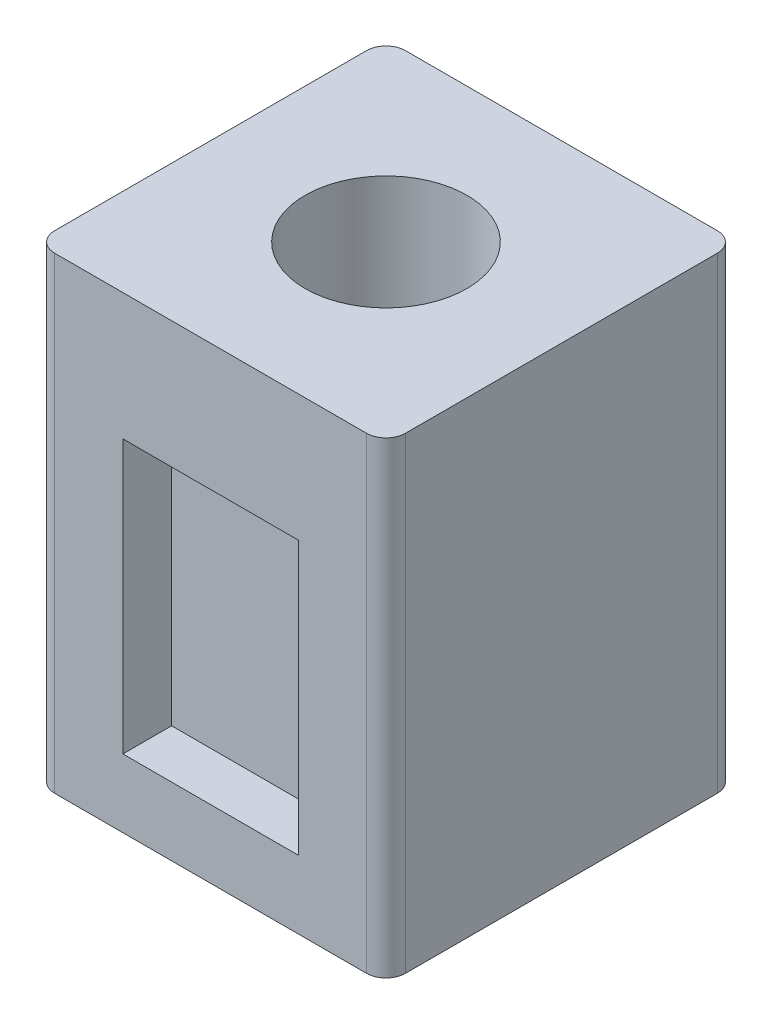
from build123d import *

# Parameters (mm, degrees)
SKETCH_1_W          = 36
SKETCH_1_H          = 48
LIFT_CARRIAGE_DEPTH = 36
FILLET_2_R          = 2
SKETCH_2_W          = 18
SKETCH_2_H          = 28
FRONT_RECESS_DEPTH  = 5
SKETCH_3_R          = 8.3
SCREW_PASSAGE_DEPTH = 70.971422738


with BuildPart() as part:
    # 草图1 → Lift_carriage (new body)
    with BuildSketch(Plane.XY):
        with Locations((18, 24)):
            Rectangle(SKETCH_1_W, SKETCH_1_H)
    extrude(amount=LIFT_CARRIAGE_DEPTH)

    # Fillet 2
    fillet_2_edges = [part.edges().sort_by_distance(p)[0] for p in [
        (36, 24, 36),
        (0, 24, 36),
        (36, 24, 0),
        (0, 24, 0),
    ]]
    fillet(fillet_2_edges, radius=FILLET_2_R)

    # 草图2 → Front_recess (cut)
    with BuildSketch(Plane.XY.offset(36)):
        with Locations((18, 21)):
            Rectangle(SKETCH_2_W, SKETCH_2_H)
    extrude(amount=-FRONT_RECESS_DEPTH, mode=Mode.SUBTRACT)

    # 草图3 → Screw_passage (cut, through all)
    with BuildSketch(Plane(origin=(0, 48, 0), x_dir=(1, 0, 0), z_dir=(0, 1, 0))):
        with Locations(Location((18, -18, 0), (0, 0, 270))):
            Circle(SKETCH_3_R)
    extrude(amount=-SCREW_PASSAGE_DEPTH, mode=Mode.SUBTRACT)


solid = part.part
